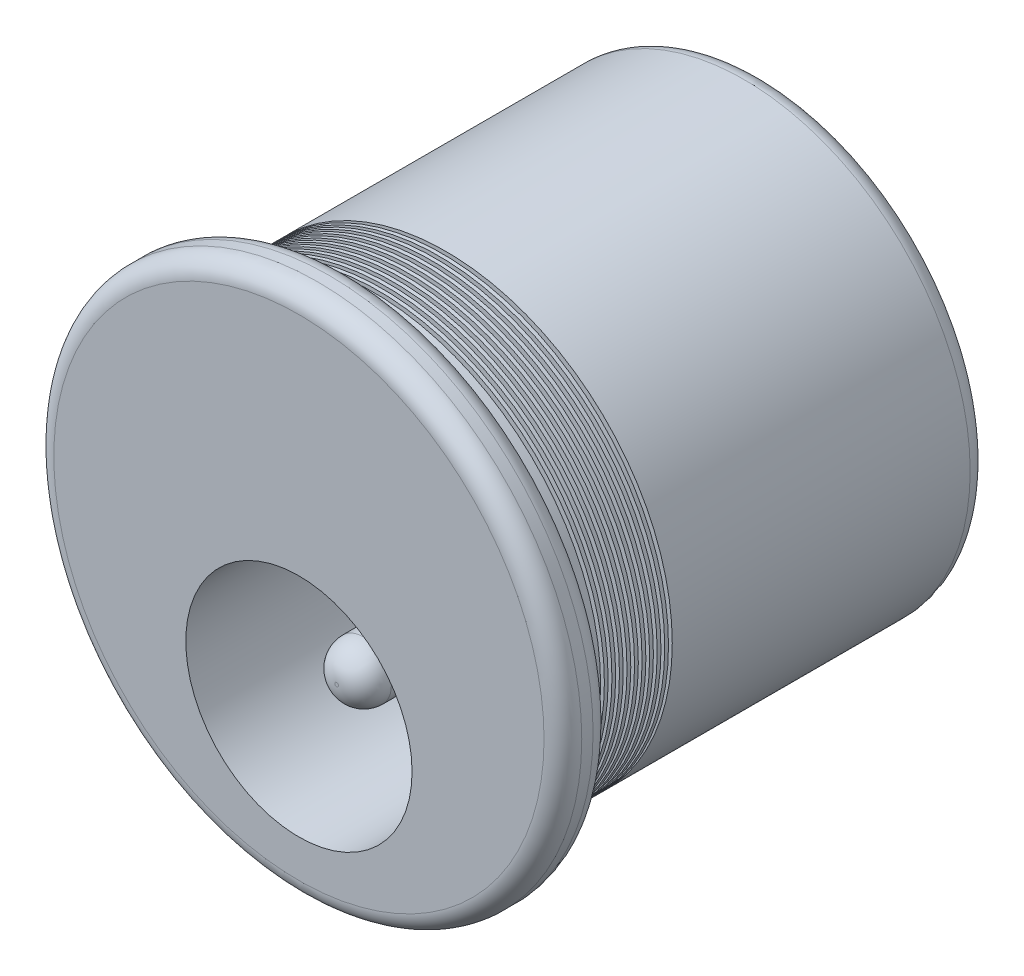
from build123d import *

# Parameters (mm, degrees)
HOLE_WIZARD_6_0_6_1_D     = 6
HOLE_WIZARD_6_0_6_1_DEPTH = 6
SKETCH_4_W                = 0.75
SKETCH_4_H                = 5
FILLET_1_R                = 0.5
FILLET_2_R                = 0.7


with BuildPart() as part:
    # 草图1 → 旋转1 (revolve)
    with BuildSketch(Plane.XZ, mode=Mode.PRIVATE) as revolve_1_sk:
        Polygon((7, 1.3), (0, 1.3), (0, -11), (6, -11), (6, -2.6), (5.75, -2.6), (5.75, -2.5), (6, -2.5), (6, -2.4), (5.75, -2.4), (5.75, -2.3), (6, -2.3), (6, -2.2), (5.75, -2.2), (5.75, -2.1), (6, -2.1), (6, -2), (5.75, -2), (5.75, -1.9), (6, -1.9), (6, -1.8), (5.75, -1.8), (5.75, -1.7), (6, -1.7), (6, -1.6), (5.75, -1.6), (5.75, -1.5), (6, -1.5), (6, -1.4), (5.75, -1.4), (5.75, -1.3), (6, -1.3), (6, -1.2), (5.75, -1.2), (5.75, -1.1), (6, -1.1), (6, -1), (5.75, -1), (5.75, -0.9), (6, -0.9), (6, -0.8), (5.75, -0.8), (5.75, -0.7), (6, -0.7), (6, 0), (7, 0), align=None)
    revolve(revolve_1_sk.sketch.rotate(Axis((0, 0, 1.3), (0, 0, -1)), 180), axis=Axis((0, 0, 1.3), (0, 0, -1)))

    # Ø6.0 (6) 直径孔1
    with Locations(Plane.XY.offset(1.3)):
        with Locations((0, -2.5)):
            Hole(HOLE_WIZARD_6_0_6_1_D / 2, depth=HOLE_WIZARD_6_0_6_1_DEPTH)

    # 草图4 → 旋转2 (revolve)
    with BuildSketch(Plane(origin=(0, -2.5, 0), x_dir=(1, 0, 0), z_dir=(0, 1, 0))):
        with Locations((0.375, 2.2)):
            Rectangle(SKETCH_4_W, SKETCH_4_H)
    revolve(axis=Axis((0, -2.5, -4.7), (0, 0, 1)))

    # 圆角1
    fillet_1_edges = [part.edges().sort_by_distance(p)[0] for p in [
        (7, 0, 0),
        (6, 0, -11),
        (7, 0, 1.3),
    ]]
    fillet(fillet_1_edges, radius=FILLET_1_R)

    # 圆角2
    fillet_2_edges = [part.edges().sort_by_distance(p)[0] for p in [
        (-0.75, -2.5, 0.3),
    ]]
    fillet(fillet_2_edges, radius=FILLET_2_R)


solid = part.part
